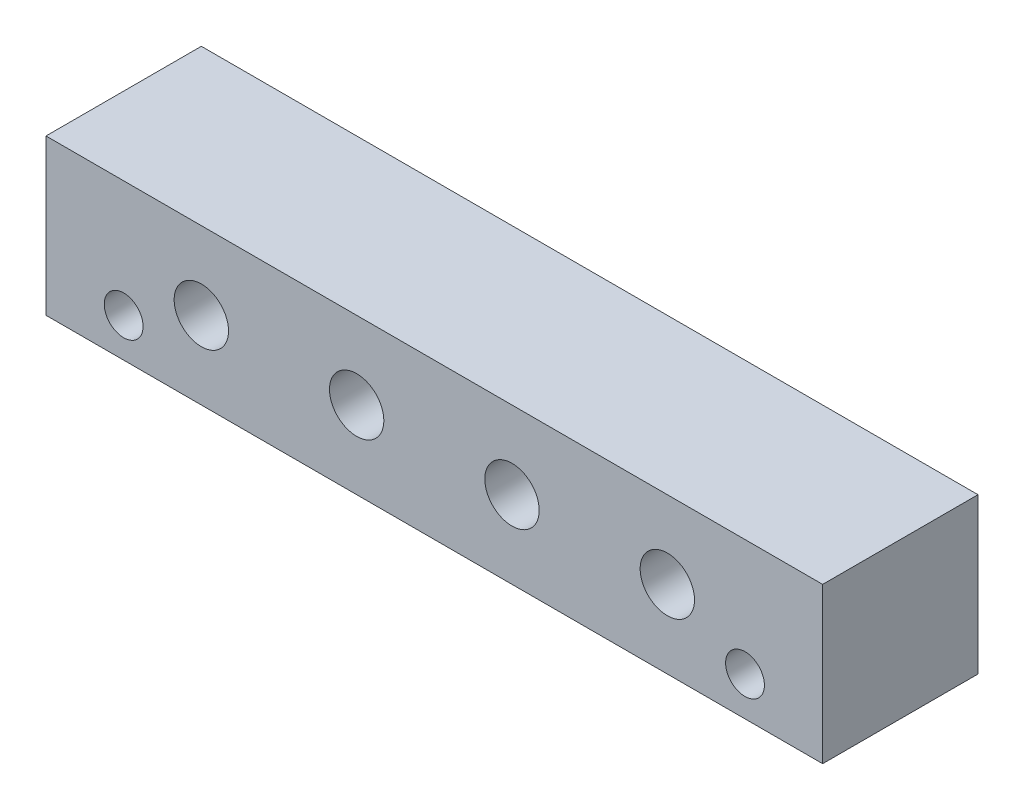
from build123d import *

# Parameters (mm, degrees)
ESQUISSE1_W        = 50
ESQUISSE1_H        = 10
ESQUISSE1_R        = 1.25
ESQUISSE1_R_2      = 1.75
BOSS_EXTRU_1_DEPTH = 10


with BuildPart() as part:
    # Esquisse1 → Boss.-Extru.1 (new body)
    with BuildSketch(Plane.XY):
        with Locations((25, 5)):
            Rectangle(ESQUISSE1_W, ESQUISSE1_H)
        with Locations((5, 2.5)):
            Circle(ESQUISSE1_R, mode=Mode.SUBTRACT)
        with Locations((45, 2.5)):
            Circle(ESQUISSE1_R, mode=Mode.SUBTRACT)
        with Locations((40, 5)):
            Circle(ESQUISSE1_R_2, mode=Mode.SUBTRACT)
        with Locations((30, 5)):
            Circle(ESQUISSE1_R_2, mode=Mode.SUBTRACT)
        with Locations((20, 5)):
            Circle(ESQUISSE1_R_2, mode=Mode.SUBTRACT)
        with Locations((10, 5)):
            Circle(ESQUISSE1_R_2, mode=Mode.SUBTRACT)
    extrude(amount=BOSS_EXTRU_1_DEPTH)


solid = part.part
